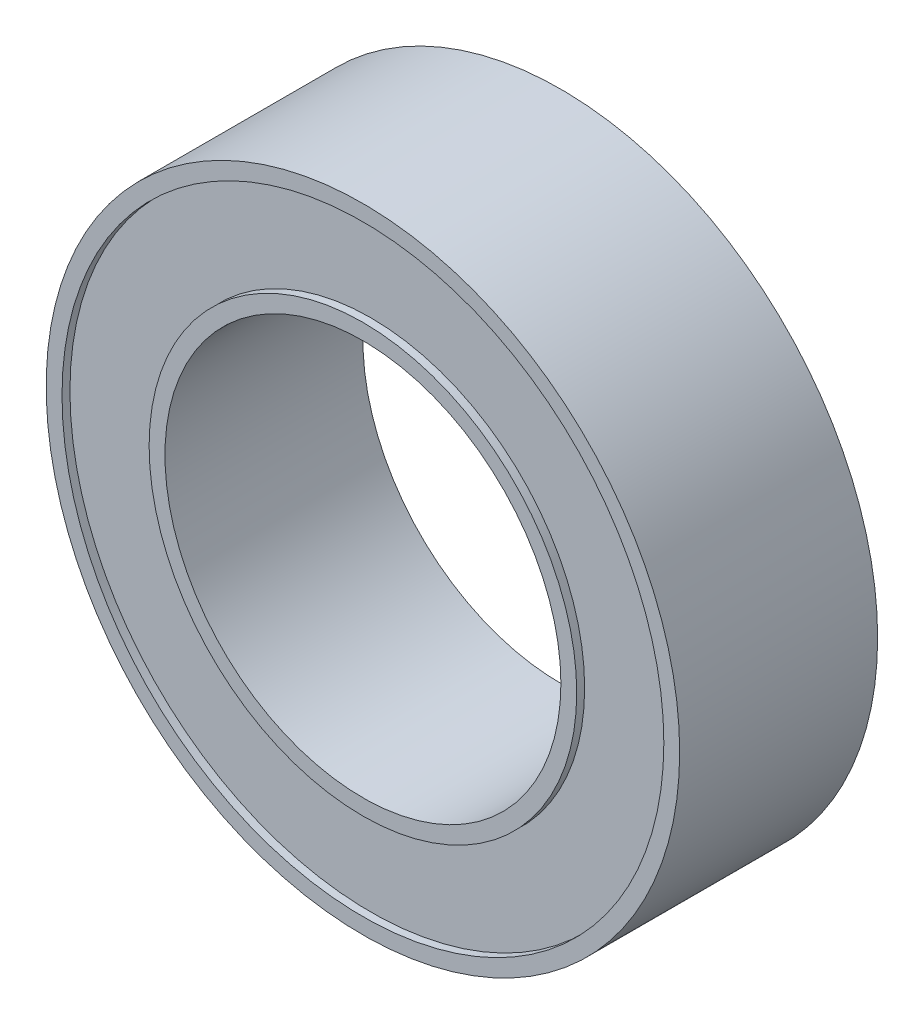
from build123d import *

# Parameters (mm, degrees)
SKETCH1_R           = 4
SKETCH1_R_2         = 2.5
BOSS_EXTRUDE1_DEPTH = 1.25
SKETCH2_R           = 3.8
SKETCH2_R_2         = 2.7
CUT_EXTRUDE1_DEPTH  = 0.1


with BuildPart() as part:
    # Sketch1 → Boss-Extrude1 (new, symmetric)
    with BuildSketch(Plane.XY):
        Circle(SKETCH1_R)
        Circle(SKETCH1_R_2, mode=Mode.SUBTRACT)
    extrude(amount=BOSS_EXTRUDE1_DEPTH, both=True)

    # Sketch2 → Cut-Extrude1 (cut)
    with BuildSketch(Plane.XY.offset(1.25)):
        Circle(SKETCH2_R)
        Circle(SKETCH2_R_2, mode=Mode.SUBTRACT)
    cut_extrude1 = extrude(amount=-CUT_EXTRUDE1_DEPTH, mode=Mode.SUBTRACT)

    # Mirror1: Cut-Extrude1 across plane
    add(cut_extrude1.mirror(Plane.XY), mode=Mode.SUBTRACT)


solid = part.part
